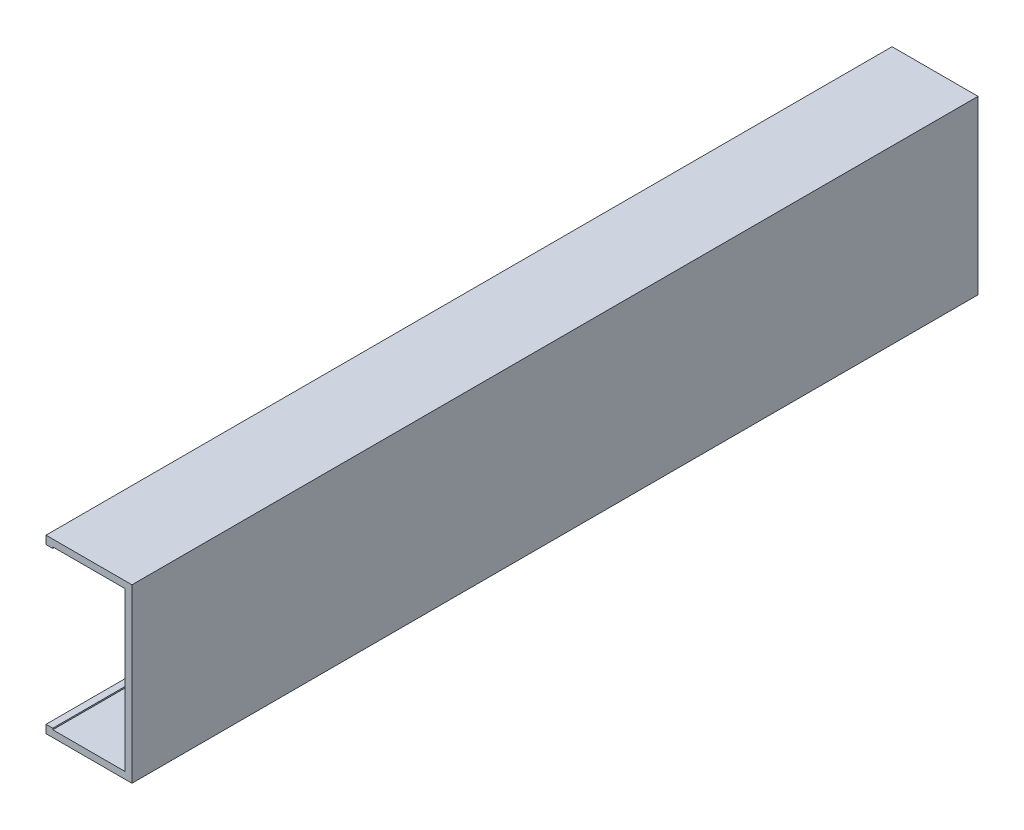
from build123d import *

# Parameters (mm, degrees)
SKETCH1_W           = 25.4
SKETCH1_H           = 50.8
SKETCH1_W_2         = 21.4
SKETCH1_H_2         = 46.8
BOSS_EXTRUDE1_DEPTH = 250
SKETCH2_W           = 80
SKETCH2_H           = 46
CUT_EXTRUDE1_DEPTH  = 20


with BuildPart() as part:
    # Sketch1 → Boss-Extrude1 (new body)
    with BuildSketch(Plane.XY):
        Rectangle(SKETCH1_W, SKETCH1_H)
        Rectangle(SKETCH1_W_2, SKETCH1_H_2, mode=Mode.SUBTRACT)
    extrude(amount=BOSS_EXTRUDE1_DEPTH)

    # Sketch2 → Cut-Extrude1 (cut)
    with BuildSketch(Plane.ZY.offset(12.7)):
        with Locations((40, 0)):
            Rectangle(SKETCH2_W, SKETCH2_H)
        with Locations((210, 0)):
            Rectangle(SKETCH2_W, SKETCH2_H)
    extrude(amount=-CUT_EXTRUDE1_DEPTH, mode=Mode.SUBTRACT)


solid = part.part
